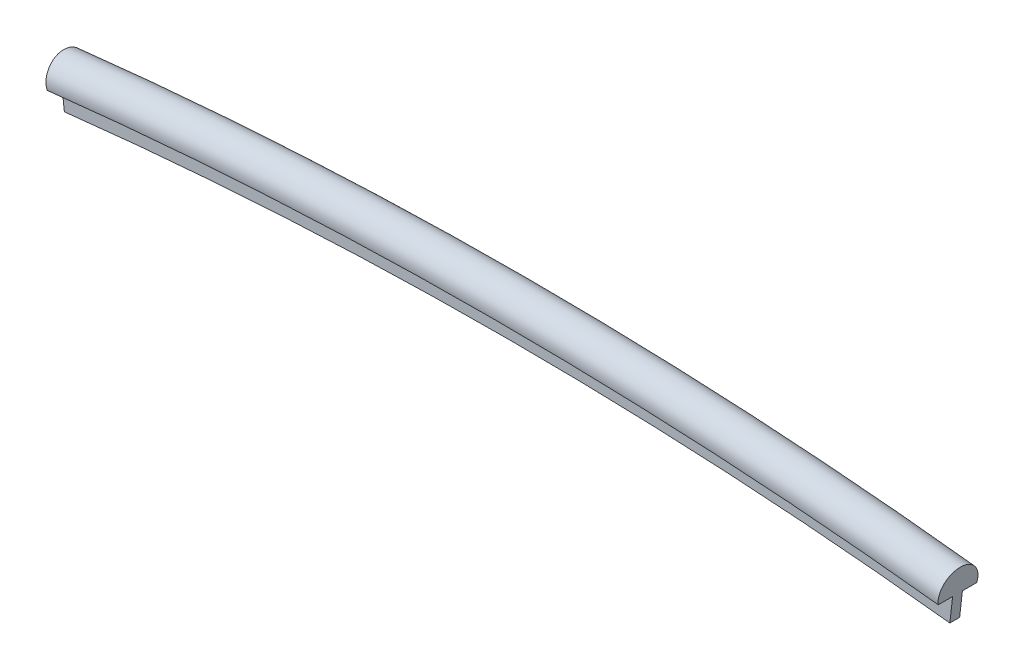
from build123d import *

# Parameters (mm, degrees)
REVOLVE1_ANGLE           = 6.488224192
REVOLVE1_OTHER_WAY_ANGLE = 6.488224192


with BuildPart() as part:
    # Sketch2 → Revolve1 (revolve)
    with BuildSketch(Plane(origin=(0, 0, 0), x_dir=(0, 0, -1), z_dir=(1, 0, 0))):
        with BuildLine():
            Line((0, 239.8), (0.3, 239.8))
            Line((0.3, 239.8), (0.3, 241.3))
            Line((0.3, 241.3), (1.18, 241.3))
            ThreePointArc((1.18, 241.3), (0, 242.800182019), (-1.18, 241.3))
            Line((-1.18, 241.3), (-0.3, 241.3))
            Line((-0.3, 241.3), (-0.3, 239.8))
            Line((-0.3, 239.8), (0, 239.8))
        make_face()
    revolve(axis=Axis((0, 0, 70.597641597), (0, 0, -1)), revolution_arc=REVOLVE1_ANGLE)

    # Sketch2 → Revolve1 other way (revolve)
    with BuildSketch(Plane(origin=(0, 0, 0), x_dir=(0, 0, -1), z_dir=(1, 0, 0))):
        with BuildLine():
            Line((0, 239.8), (0.3, 239.8))
            Line((0.3, 239.8), (0.3, 241.3))
            Line((0.3, 241.3), (1.18, 241.3))
            ThreePointArc((1.18, 241.3), (0, 242.800182019), (-1.18, 241.3))
            Line((-1.18, 241.3), (-0.3, 241.3))
            Line((-0.3, 241.3), (-0.3, 239.8))
            Line((-0.3, 239.8), (0, 239.8))
        make_face()
    revolve(axis=Axis((0, 0, 70.597641597), (0, 0, 1)), revolution_arc=REVOLVE1_OTHER_WAY_ANGLE)


solid = part.part
